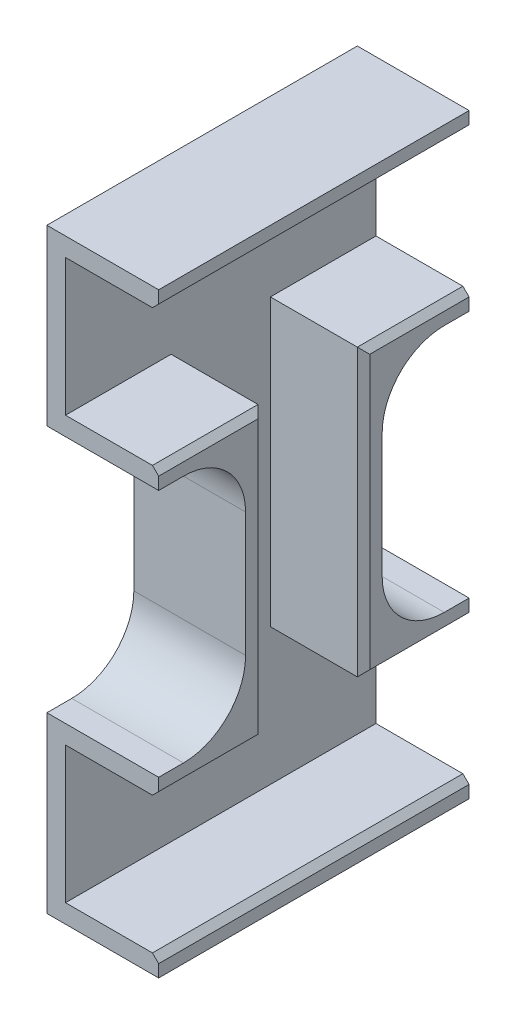
from build123d import *

# Parameters (mm, degrees)
SKETCH1_W           = 22
SKETCH1_H           = 40
SKETCH1_W_2         = 50
SKETCH1_H_2         = 28
BOSS_EXTRUDE1_DEPTH = 18
SKETCH2_W           = 16
SKETCH2_H           = 46
CUT_EXTRUDE1_DEPTH  = 15
FILLET1_R           = 10
CHAMFER1_SIZE       = 1


with BuildPart() as part:
    # Sketch1 → Boss-Extrude1 (new body)
    with BuildSketch(Plane(origin=(0, 0, 0), x_dir=(0, 0, -1), z_dir=(1, 0, 0))):
        Polygon((0, 68), (14, 68), (36, 68), (50, 68), (50, 96), (0, 96), align=None)
        with Locations((25, 48)):
            Rectangle(SKETCH1_W, SKETCH1_H)
        with Locations((25, 14)):
            Rectangle(SKETCH1_W_2, SKETCH1_H_2)
    extrude(amount=BOSS_EXTRUDE1_DEPTH)

    # Sketch2 → Cut-Extrude1 (cut)
    with BuildSketch(Plane(origin=(18, 0, 0), x_dir=(0, 0, -1), z_dir=(1, 0, 0))):
        Polygon((50, 93), (0, 93), (0, 71), (17, 71), (33, 71), (50, 71), align=None)
        with Locations((25, 48)):
            Rectangle(SKETCH2_W, SKETCH2_H)
        Polygon((33, 25), (17, 25), (0, 25), (0, 3), (50, 3), (50, 25), align=None)
    extrude(amount=-CUT_EXTRUDE1_DEPTH, mode=Mode.SUBTRACT)

    # Fillet1
    fillet1_edges = [part.edges().sort_by_distance(p)[0] for p in [
        (9, 68, -36),
        (9, 28, -36),
        (9, 28, -14),
        (9, 68, -14),
    ]]
    fillet(fillet1_edges, radius=FILLET1_R)

    # Chamfer1
    chamfer1_edges = [part.edges().sort_by_distance(p)[0] for p in [
        (18, 93, -25),
        (18, 48, -33),
        (18, 25, -41.5),
        (18, 25, -8.5),
        (18, 71, -8.5),
        (18, 48, -17),
        (18, 3, -25),
        (18, 71, -41.5),
    ]]
    chamfer(chamfer1_edges, length=CHAMFER1_SIZE)


solid = part.part
